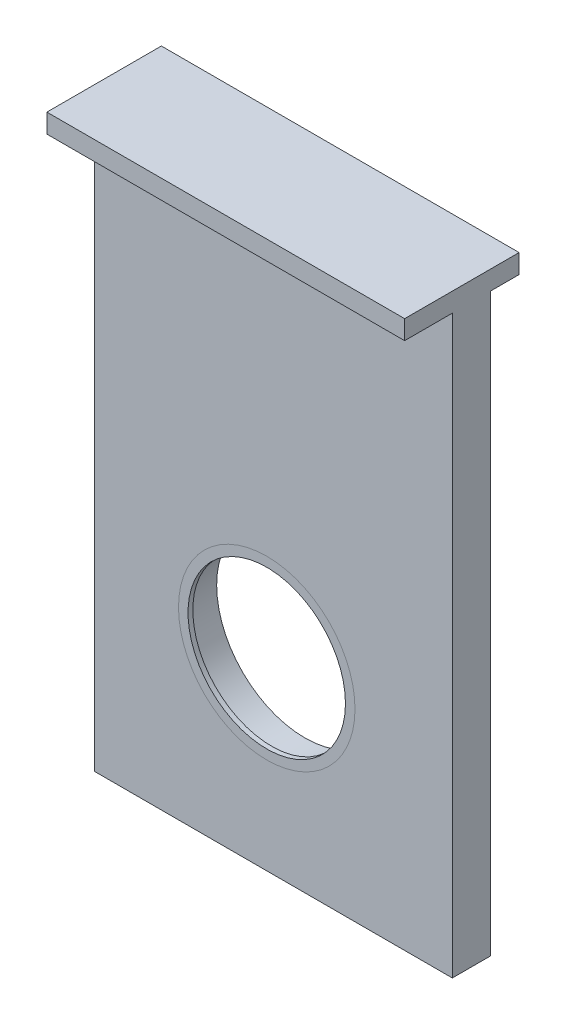
from build123d import *

# Parameters (mm, degrees)
SKETCH12_W                = 75
SKETCH12_H                = 124.71
BOSS_EXTRUDE10_DEPTH      = 8
BOSS_EXTRUDE13_DEPTH      = 10
BOSS_EXTRUDE13_DEPTH_BACK = 14
SKETCH24_W                = 75
SKETCH24_H                = 4
SKETCH25_R                = 18.5
CUT_EXTRUDE1_DEPTH        = 186.881905155
SKETCH26_R                = 18.5
SKETCH26_R_2              = 16.5
BOSS_EXTRUDE15_DEPTH      = 1


with BuildPart() as part:
    # Sketch12 → Boss-Extrude10 (new body)
    with BuildSketch(Plane.XY):
        with Locations((99.625849364, 62.355)):
            Rectangle(SKETCH12_W, SKETCH12_H)
    extrude(amount=BOSS_EXTRUDE10_DEPTH)

    # Sketch24 → Boss-Extrude13 (add, two sides: drawn at the far end of the back side and taken through both)
    with BuildSketch(Plane.XY.offset(8).offset(-BOSS_EXTRUDE13_DEPTH_BACK)):
        with Locations((99.625849364, 122.71)):
            Rectangle(SKETCH24_W, SKETCH24_H)
    extrude(amount=BOSS_EXTRUDE13_DEPTH + BOSS_EXTRUDE13_DEPTH_BACK)

    # Sketch25 → Cut-Extrude1 (cut, through all)
    with BuildSketch(Plane.XY.offset(8)):
        with Locations((98.219620603, 38.627603634)):
            Circle(SKETCH25_R)
    extrude(amount=-CUT_EXTRUDE1_DEPTH, mode=Mode.SUBTRACT)


with BuildPart() as body_2:
    # Sketch26 → Boss-Extrude15 (new body)
    with BuildSketch(Plane.XY.offset(8)):
        with Locations((98.219620603, 38.627603634)):
            Circle(SKETCH26_R)
        with Locations((98.219620603, 38.627603634)):
            Circle(SKETCH26_R_2, mode=Mode.SUBTRACT)
    extrude(amount=-BOSS_EXTRUDE15_DEPTH)


solid = Compound([part.part, body_2.part])
